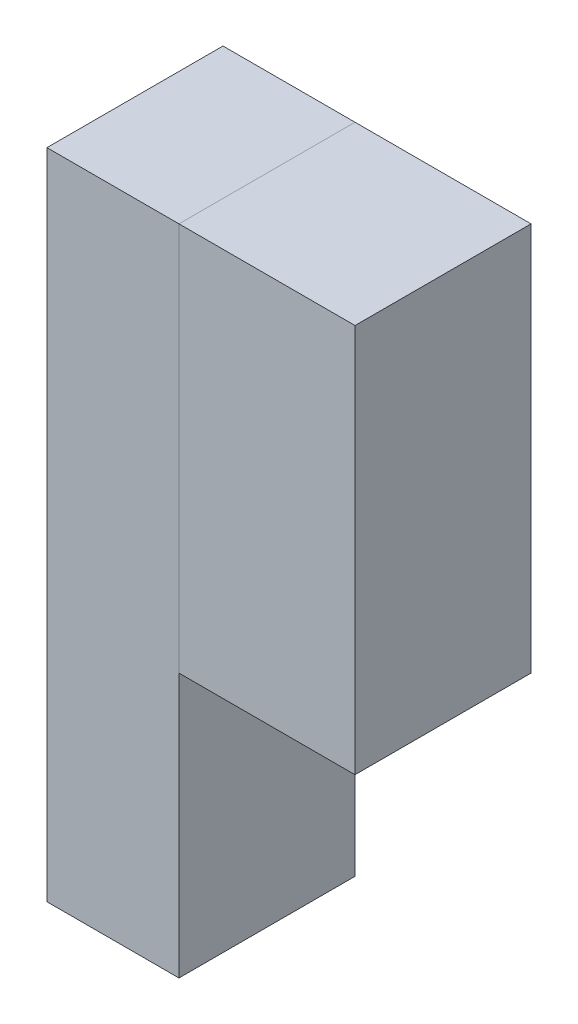
from build123d import *

# Parameters (mm, degrees)
SKETCH_1_W      = 450
SKETCH_1_H      = 600
EXTRUDE_1_DEPTH = 2226
SKETCH_2_W      = 600
SKETCH_2_H      = 1326
EXTRUDE_2_DEPTH = 600


with BuildPart() as part:
    # Эскиз1 → Бобышка-Вытянуть1 (new body)
    with BuildSketch(Plane(origin=(0, 0, 0), x_dir=(1, 0, 0), z_dir=(0, 1, 0))):
        with Locations((225, 300)):
            Rectangle(SKETCH_1_W, SKETCH_1_H)
    extrude(amount=EXTRUDE_1_DEPTH)


with BuildPart() as body_2:
    # Эскиз2 → Бобышка-Вытянуть2 (new body)
    with BuildSketch(Plane(origin=(450, 0, 0), x_dir=(0, 0, -1), z_dir=(1, 0, 0))):
        with Locations((300, 1563)):
            Rectangle(SKETCH_2_W, SKETCH_2_H)
    extrude(amount=EXTRUDE_2_DEPTH)


solid = Compound([part.part, body_2.part])
